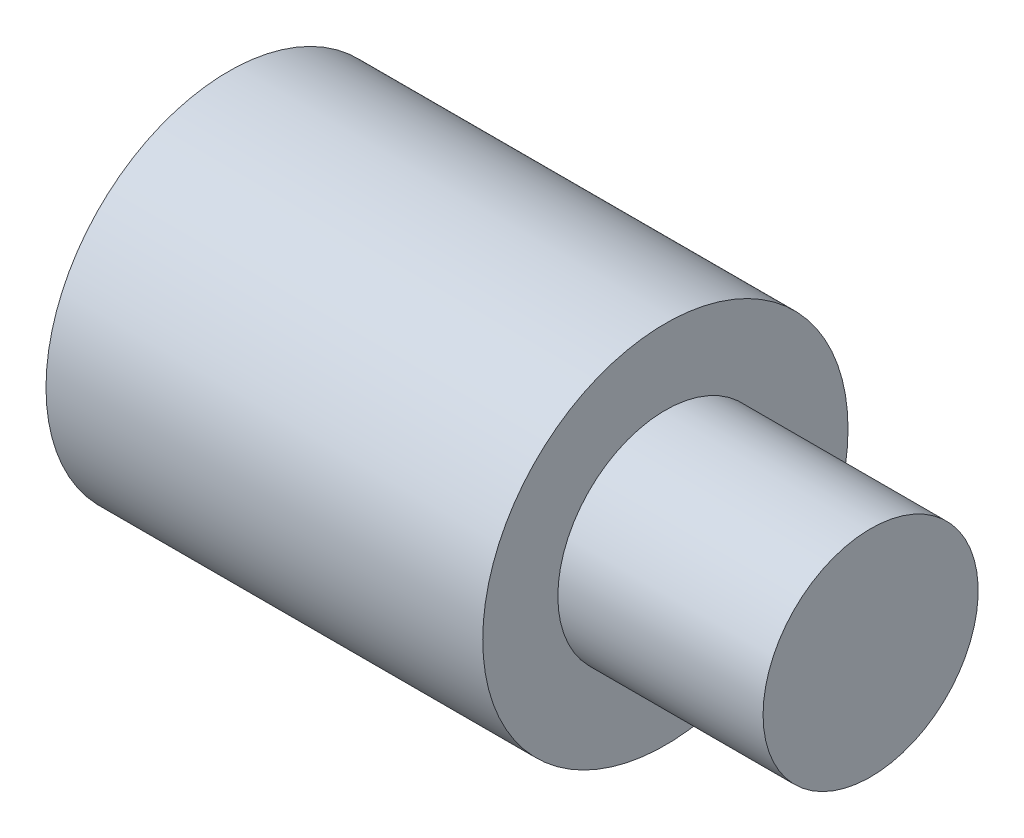
from build123d import *

# Parameters (mm, degrees)
SOCKET_SKETCH_W = 23.9
SOCKET_SKETCH_H = 6.35


with BuildPart() as part:
    # Conn_T8_ORB6 Sketch → Conn_T8_ORB6 (revolve)
    with BuildSketch(Plane.XY):
        Polygon((12.5, 0), (12.5, 6.55), (0, 6.55), (0, 11.124), (-26.6, 11.124), (-26.6, 0), align=None)
    revolve(axis=Axis((-1000, 0, 0), (1, 0, 0)))

    # Socket Sketch → Socket (revolve, cut)
    with BuildSketch(Plane.XY):
        with Locations((-15.65, 3.175)):
            Rectangle(SOCKET_SKETCH_W, SOCKET_SKETCH_H)
    revolve(axis=Axis((-1000, 0, 0), (1, 0, 0)), mode=Mode.SUBTRACT)


solid = part.part
